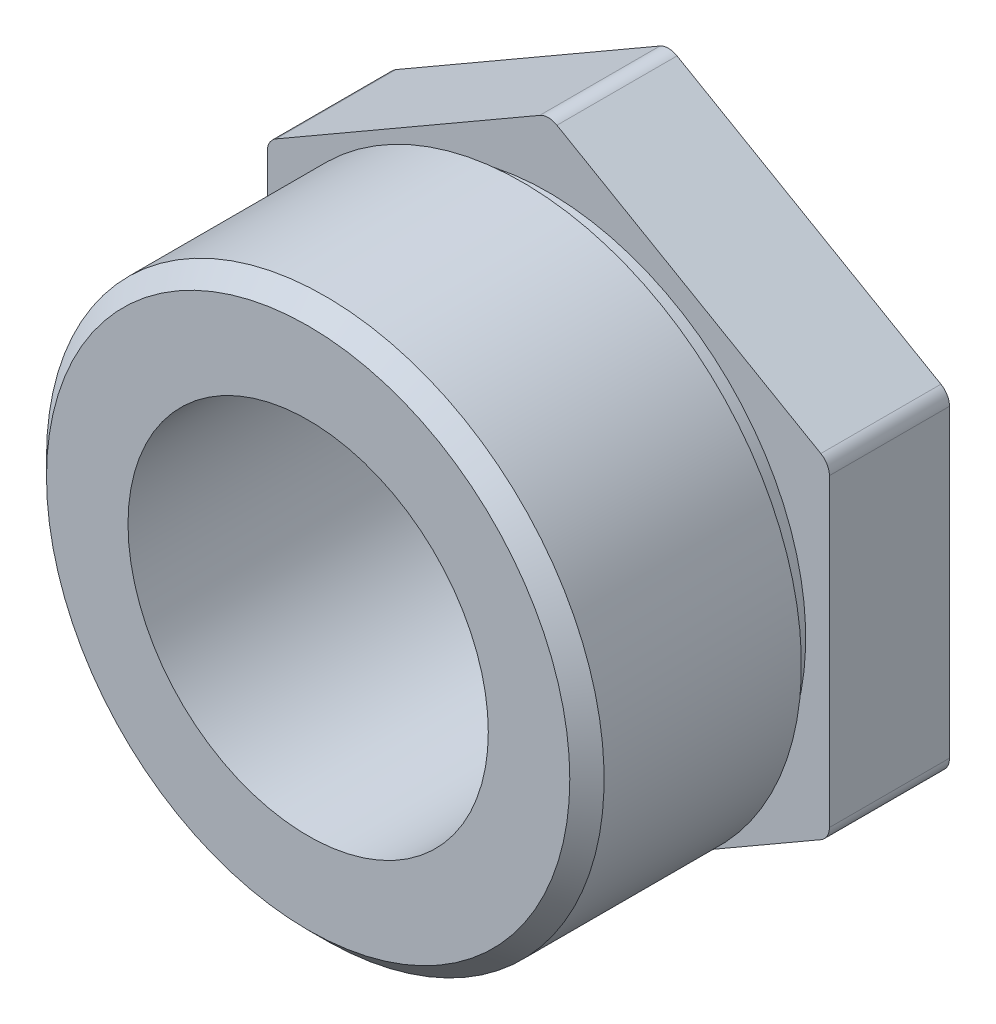
from build123d import *

# Parameters (mm, degrees)
SKETCH1_R           = 32.5
BOSS_EXTRUDE1_DEPTH = 42
CUT_EXTRUDE1_START  = -28
SKETCH2_R           = 32.5
SKETCH2_R_2         = 30
CUT_EXTRUDE1_DEPTH  = 3
BOSS_EXTRUDE2_DEPTH = 14
FILLET1_R           = 2
CHAMFER1_SIZE       = 2
SKETCH4_R           = 21
CUT_EXTRUDE3_DEPTH  = 66.153392256


with BuildPart() as part:
    # Sketch1 → Boss-Extrude1 (new body)
    with BuildSketch(Plane.XY):
        with Locations(Location((0, 0, 0), (0, 0, 180))):
            Circle(SKETCH1_R)
    extrude(amount=BOSS_EXTRUDE1_DEPTH)

    # Sketch2 → Cut-Extrude1 (cut)
    with BuildSketch(Plane.XY.offset(42).offset(CUT_EXTRUDE1_START)):
        with Locations(Location((0, 0, 0), (0, 0, 180))):
            Circle(SKETCH2_R)
        Circle(SKETCH2_R_2, mode=Mode.SUBTRACT)
    extrude(amount=CUT_EXTRUDE1_DEPTH, mode=Mode.SUBTRACT)

    # Sketch3 → Boss-Extrude2 (add)
    with BuildSketch(Plane(origin=(0, 0, 0), x_dir=(-1, 0, 0), z_dir=(0, 0, -1))):
        Polygon((0, -37.828766952), (32.760673174, -18.914383476), (32.760673174, 18.914383476), (0, 37.828766952), (-32.760673174, 18.914383476), (-32.760673174, -18.914383476), align=None)
    extrude(amount=-BOSS_EXTRUDE2_DEPTH)

    # Fillet1
    fillet1_edges = [part.edges().sort_by_distance(p)[0] for p in [
        (0, -37.828766952, 7),
        (32.760673174, -18.914383476, 7),
        (32.760673174, 18.914383476, 7),
        (0, 37.828766952, 7),
        (-32.760673174, 18.914383476, 7),
        (-32.760673174, -18.914383476, 7),
    ]]
    fillet(fillet1_edges, radius=FILLET1_R)

    # Chamfer1
    chamfer1_edges = [part.edges().sort_by_distance(p)[0] for p in [
        (32.5, 0, 42),
    ]]
    chamfer(chamfer1_edges, length=CHAMFER1_SIZE)

    # Sketch4 → Cut-Extrude3 (cut, through all)
    with BuildSketch(Plane.XY.offset(42)):
        Circle(SKETCH4_R)
    extrude(amount=-CUT_EXTRUDE3_DEPTH, mode=Mode.SUBTRACT)


solid = part.part
